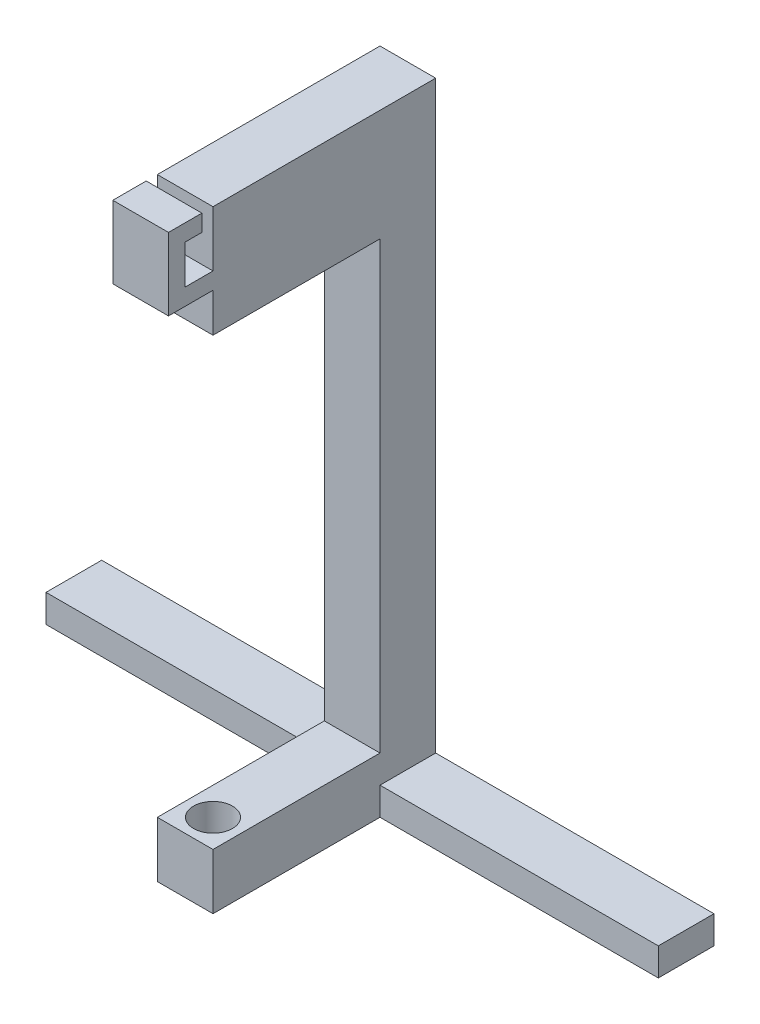
from build123d import *

# Parameters (mm, degrees)
SKICA1_W                      = 10
SKICA1_H                      = 10
P_IDAT_VYSUNUT_M1_DEPTH       = 10
SKICA2_R                      = 3.5
ODEBRAT_VYSUNUT_M1_DEPTH      = 5
SKICA6_W                      = 10
SKICA6_H                      = 10
P_IDAT_VYSUNUT_M9_DEPTH       = 30
SKICA7_W                      = 10
SKICA7_H                      = 10
P_IDAT_VYSUNUT_M11_DEPTH      = 100
SKICA8_W                      = 10
SKICA8_H                      = 10
P_IDAT_VYSUNUT_M12_DEPTH      = 30
SKICA9_W                      = 10
SKICA9_H                      = 10
P_IDAT_VYSUNUT_M13_DEPTH      = 10
SKICA10_R                     = 3.5
ODEBRAT_VYSUNUT_M2_DEPTH      = 10
SKICA20_W                     = 10
SKICA20_H                     = 10
P_IDAT_VYSUNUT_M21_DEPTH      = 20
P_IDAT_VYSUNUT_M22_DEPTH      = 50
P_IDAT_VYSUNUT_M22_DEPTH_BACK = 60
SKICA11_W                     = 10
SKICA11_H                     = 5
SKICA10_2_R                   = 3.5
ODEBRAT_VYSUNUT_M7_DEPTH      = 15
SKICA21_W                     = 10
SKICA21_H                     = 3
P_IDAT_VYSUNUT_M24_DEPTH      = 8
SKICA22_W                     = 10
SKICA22_H                     = 3
P_IDAT_VYSUNUT_M25_DEPTH      = 10
SKICA23_W                     = 10
SKICA23_H                     = 3
P_IDAT_VYSUNUT_M26_DEPTH      = 3


with BuildPart() as part:
    # Skica1 → Přidat vysunutím1 (new body)
    with BuildSketch(Plane.XY):
        with Locations((5, 5)):
            Rectangle(SKICA1_W, SKICA1_H)
    extrude(amount=P_IDAT_VYSUNUT_M1_DEPTH)

    # Skica2 → Odebrat vysunutím1 (cut)
    with BuildSketch(Plane(origin=(0, 10, 0), x_dir=(1, 0, 0), z_dir=(0, 1, 0))):
        with Locations((5, -5)):
            Circle(SKICA2_R)
    extrude(amount=-ODEBRAT_VYSUNUT_M1_DEPTH, mode=Mode.SUBTRACT)

    # Skica6 → Přidat vysunutím9 (add)
    with BuildSketch(Plane(origin=(0, 0, 0), x_dir=(-1, 0, 0), z_dir=(0, 0, -1))):
        with Locations((-5, 5)):
            Rectangle(SKICA6_W, SKICA6_H)
    extrude(amount=P_IDAT_VYSUNUT_M9_DEPTH)

    # Skica7 → Přidat vysunutím11 (add)
    with BuildSketch(Plane(origin=(0, 10, 0), x_dir=(1, 0, 0), z_dir=(0, 1, 0))):
        with Locations((5, 25)):
            Rectangle(SKICA7_W, SKICA7_H)
    extrude(amount=P_IDAT_VYSUNUT_M11_DEPTH)

    # Skica8 → Přidat vysunutím12 (add)
    with BuildSketch(Plane.XY.offset(-20)):
        with Locations((5, 105)):
            Rectangle(SKICA8_W, SKICA8_H)
    extrude(amount=P_IDAT_VYSUNUT_M12_DEPTH)

    # Skica9 → Přidat vysunutím13 (add)
    with BuildSketch(Plane.XZ.offset(-100)):
        with Locations((5, 5)):
            Rectangle(SKICA9_W, SKICA9_H)
    extrude(amount=P_IDAT_VYSUNUT_M13_DEPTH)

    # Skica10 → Odebrat vysunutím2 (cut)
    with BuildSketch(Plane.XZ.offset(-90)):
        with Locations((4.797944497, 5)):
            Circle(SKICA10_R)
    extrude(amount=-ODEBRAT_VYSUNUT_M2_DEPTH, mode=Mode.SUBTRACT)

    # Skica20 → Přidat vysunutím21 (add)
    with BuildSketch(Plane(origin=(0, 0, 0), x_dir=(-1, 0, 0), z_dir=(0, 0, -1))):
        with Locations((-5, 95)):
            Rectangle(SKICA20_W, SKICA20_H)
    extrude(amount=P_IDAT_VYSUNUT_M21_DEPTH)

    # Skica11 → Přidat vysunutím22 (add, two sides: drawn at the far end of the back side and taken through both)
    with BuildSketch(Plane(origin=(10, 0, 0), x_dir=(0, 0, -1), z_dir=(1, 0, 0)).offset(-P_IDAT_VYSUNUT_M22_DEPTH_BACK)):
        with Locations((25, 2.5)):
            Rectangle(SKICA11_W, SKICA11_H)
    extrude(amount=P_IDAT_VYSUNUT_M22_DEPTH + P_IDAT_VYSUNUT_M22_DEPTH_BACK)

    # Skica10<2> → Odebrat vysunutím7 (cut)
    with BuildSketch(Plane.XZ.offset(-90)):
        with Locations((4.797944497, 5)):
            Circle(SKICA10_2_R)
    extrude(amount=-ODEBRAT_VYSUNUT_M7_DEPTH, mode=Mode.SUBTRACT)

    # Skica21 → Přidat vysunutím24 (add)
    with BuildSketch(Plane.XY.offset(10)):
        with Locations((5, 98.5)):
            Rectangle(SKICA21_W, SKICA21_H)
    extrude(amount=P_IDAT_VYSUNUT_M24_DEPTH)

    # Skica22 → Přidat vysunutím25 (add)
    with BuildSketch(Plane(origin=(0, 100, 0), x_dir=(1, 0, 0), z_dir=(0, 1, 0))):
        with Locations((5, -16.5)):
            Rectangle(SKICA22_W, SKICA22_H)
    extrude(amount=P_IDAT_VYSUNUT_M25_DEPTH)

    # Skica23 → Přidat vysunutím26 (add)
    with BuildSketch(Plane(origin=(0, 0, 15), x_dir=(-1, 0, 0), z_dir=(0, 0, -1))):
        with Locations((-5, 108.5)):
            Rectangle(SKICA23_W, SKICA23_H)
    extrude(amount=P_IDAT_VYSUNUT_M26_DEPTH)


solid = part.part
